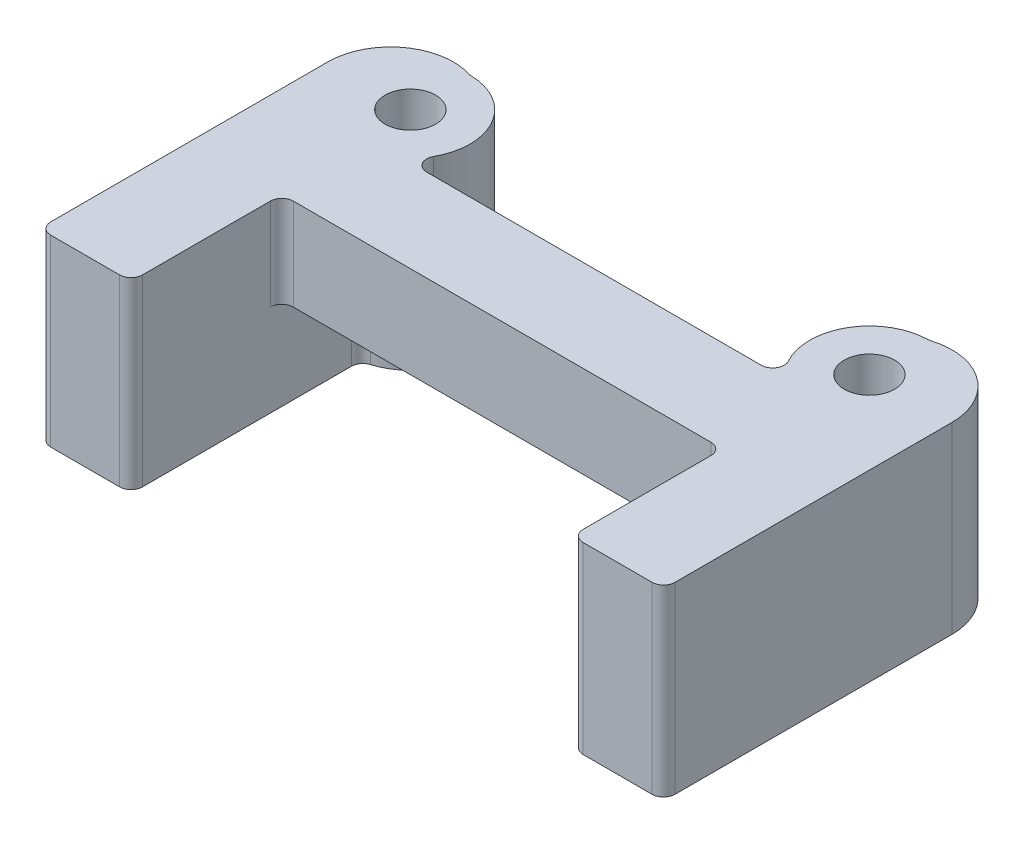
from build123d import *

# Parameters (mm, degrees)
SKETCH1_R           = 1.1
BASE_DEPTH          = 8
BOSS_EXTRUDE2_START = -4
BOSS_EXTRUDE2_DEPTH = 4
FILLET1_R           = 0.5


with BuildPart() as part:
    # Sketch1 → Base (new body)
    with BuildSketch(Plane(origin=(0, 0, 0), x_dir=(1, 0, 0), z_dir=(0, 1, 0))):
        with BuildLine():
            Line((3.6, 0), (3.6, -12.569046516))
            Line((3.6, -12.569046516), (-0.4, -12.569046516))
            Line((-0.4, -12.569046516), (-0.4, -2.569046516))
            ThreePointArc((-0.4, -2.569046516), (-2.592250079, 0.20059793), (0, 2.6))
            ThreePointArc((0, 2.6), (2.464704684, 2.220360331), (3.6, 0))
        make_face()
        with Locations(Location((0, 0, 0), (0, 0, 270))):
            Circle(SKETCH1_R, mode=Mode.SUBTRACT)
    extrude(amount=BASE_DEPTH)

    # Sketch2 → Boss-Extrude2 (add)
    with BuildSketch(Plane(origin=(0, 8, 0), x_dir=(1, 0, 0), z_dir=(0, 1, 0)).offset(BOSS_EXTRUDE2_START)):
        with BuildLine():
            ThreePointArc((-0.4, -2.569046516), (-1.069213935, -2.369975013), (-1.661324773, -2))
            Line((-1.661324773, -2), (-10, -2))
            Line((-10, -2), (-10, -6))
            Line((-10, -6), (-0.4, -6))
            Line((-0.4, -6), (-0.4, -2.569046516))
        make_face()
    extrude(amount=BOSS_EXTRUDE2_DEPTH)

    # Mirror2: part across plane


with BuildPart() as part_1:
    add(part.part)
    add(part.part.mirror(Plane.ZY.offset(10)))

    # Fillet1
    fillet1_edges = [part_1.edges().sort_by_distance(p)[0] for p in [
        (-0.4, 2, 2.569046516),
        (-1.661324773, 6, 2),
        (-0.4, 6, 6),
        (-20, 4, -2.6),
        (-19.6, 2, 2.569046516),
        (-19.6, 4, 12.569046516),
        (-19.6, 6, 6),
        (-23.6, 4, 12.569046516),
        (-18.338675227, 6, 2),
        (3.6, 4, 12.569046516),
        (-0.4, 4, 12.569046516),
        (0, 4, -2.6),
    ]]
    fillet(fillet1_edges, radius=FILLET1_R)


solid = part_1.part
